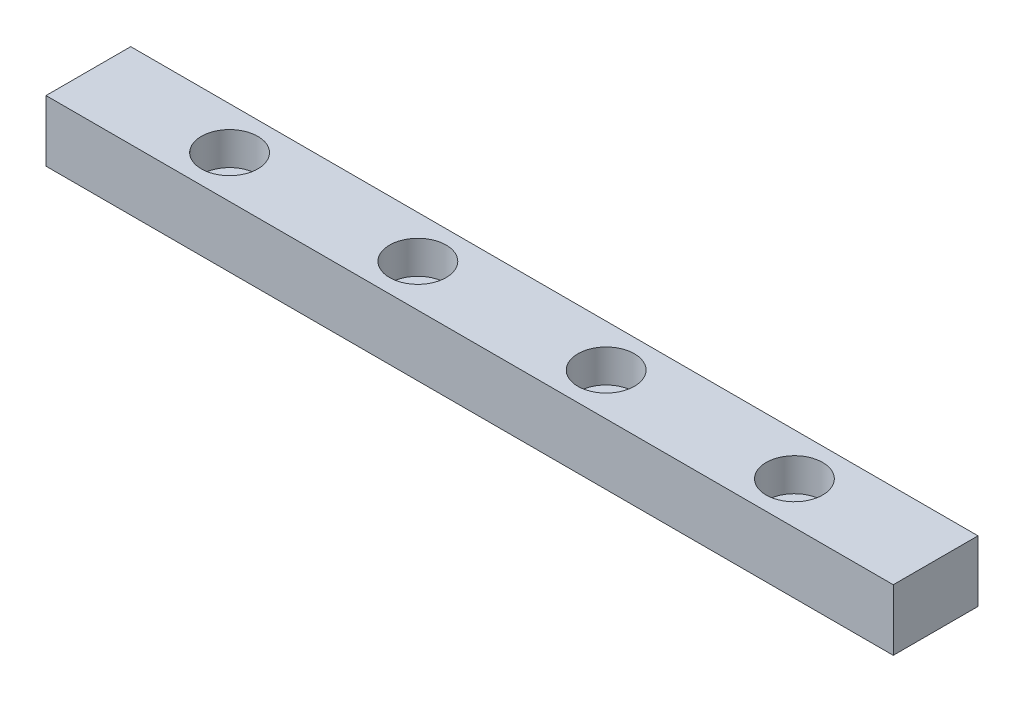
from build123d import *

# Parameters (mm, degrees)
SKETCH_2_W          = 9
SKETCH_2_H          = 6.5
EXTRUDE_1_DEPTH     = 90
SKETCH_3_R          = 3
CUT_EXTRUDE_1_DEPTH = 3.5
SKETCH_4_R          = 1.75
CUT_EXTRUDE_2_DEPTH = 91.346554998


with BuildPart() as part:
    # 草图2 → 凸台-拉伸1 (new body)
    with BuildSketch(Plane(origin=(0, 0, 0), x_dir=(0, 0, -1), z_dir=(1, 0, 0))):
        Rectangle(SKETCH_2_W, SKETCH_2_H)
    extrude(amount=EXTRUDE_1_DEPTH)

    # 草图3 → 切除-拉伸1 (cut)
    with BuildSketch(Plane(origin=(0, 3.25, 0), x_dir=(1, 0, 0), z_dir=(0, 1, 0))):
        with Locations(Location((15, 0, 0), (0, 0, 270))):
            Circle(SKETCH_3_R)
        with Locations(Location((35, 0, 0), (0, 0, 270))):
            Circle(SKETCH_3_R)
        with Locations(Location((55, 0, 0), (0, 0, 270))):
            Circle(SKETCH_3_R)
        with Locations(Location((75, 0, 0), (0, 0, 270))):
            Circle(SKETCH_3_R)
        with Locations((95, 0)):
            Circle(SKETCH_3_R)
        with Locations((115, 0)):
            Circle(SKETCH_3_R)
        with Locations((135, 0)):
            Circle(SKETCH_3_R)
        with Locations((155, 0)):
            Circle(SKETCH_3_R)
        with Locations((175, 0)):
            Circle(SKETCH_3_R)
        with Locations((195, 0)):
            Circle(SKETCH_3_R)
        with Locations((215, 0)):
            Circle(SKETCH_3_R)
        with Locations((235, 0)):
            Circle(SKETCH_3_R)
        with Locations((255, 0)):
            Circle(SKETCH_3_R)
    extrude(amount=-CUT_EXTRUDE_1_DEPTH, mode=Mode.SUBTRACT)

    # 草图4 → 切除-拉伸2 (cut, through all)
    with BuildSketch(Plane(origin=(0, 3.25, 0), x_dir=(1, 0, 0), z_dir=(0, 1, 0))):
        with Locations(Location((15, 0, 0), (0, 0, 270))):
            Circle(SKETCH_4_R)
        with Locations(Location((35, 0, 0), (0, 0, 270))):
            Circle(SKETCH_4_R)
        with Locations(Location((55, 0, 0), (0, 0, 270))):
            Circle(SKETCH_4_R)
        with Locations(Location((75, 0, 0), (0, 0, 270))):
            Circle(SKETCH_4_R)
        with Locations((95, 0)):
            Circle(SKETCH_4_R)
        with Locations((115, 0)):
            Circle(SKETCH_4_R)
        with Locations((135, 0)):
            Circle(SKETCH_4_R)
        with Locations((155, 0)):
            Circle(SKETCH_4_R)
        with Locations((175, 0)):
            Circle(SKETCH_4_R)
        with Locations((195, 0)):
            Circle(SKETCH_4_R)
        with Locations((215, 0)):
            Circle(SKETCH_4_R)
        with Locations((235, 0)):
            Circle(SKETCH_4_R)
        with Locations((255, 0)):
            Circle(SKETCH_4_R)
    extrude(amount=-CUT_EXTRUDE_2_DEPTH, mode=Mode.SUBTRACT)


solid = part.part
